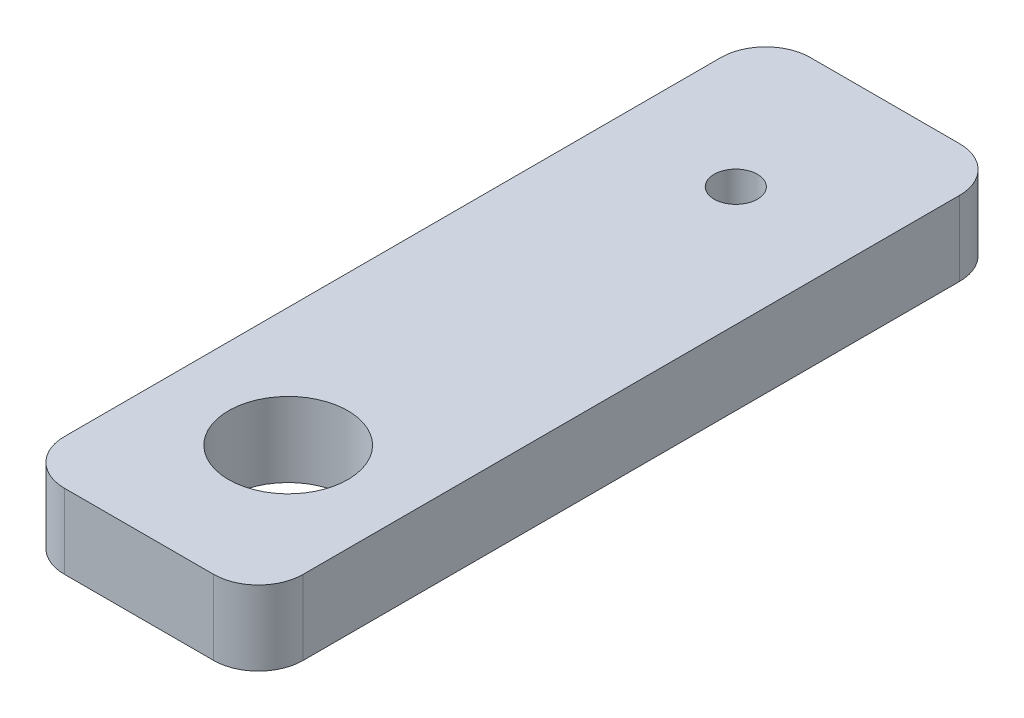
from build123d import *

# Parameters (mm, degrees)
SKETCH1_W           = 16
SKETCH1_H           = 50
SKETCH1_R           = 1.45
SKETCH1_R_2         = 4
BOSS_EXTRUDE1_DEPTH = 5
FILLET1_R           = 3


with BuildPart() as part:
    # Sketch1 → Boss-Extrude1 (new body)
    with BuildSketch(Plane(origin=(0, 0, 0), x_dir=(1, 0, 0), z_dir=(0, 1, 0))):
        with Locations((8, 25)):
            Rectangle(SKETCH1_W, SKETCH1_H)
        with Locations(Location((8, 40, 0), (0, 0, 270))):
            Circle(SKETCH1_R, mode=Mode.SUBTRACT)
        with Locations(Location((8, 10, 0), (0, 0, 270))):
            Circle(SKETCH1_R_2, mode=Mode.SUBTRACT)
    extrude(amount=BOSS_EXTRUDE1_DEPTH)

    # Fillet1
    fillet1_edges = [part.edges().sort_by_distance(p)[0] for p in [
        (0, 2.5, -50),
        (16, 2.5, -50),
        (16, 2.5, 0),
        (0, 2.5, 0),
    ]]
    fillet(fillet1_edges, radius=FILLET1_R)


solid = part.part
